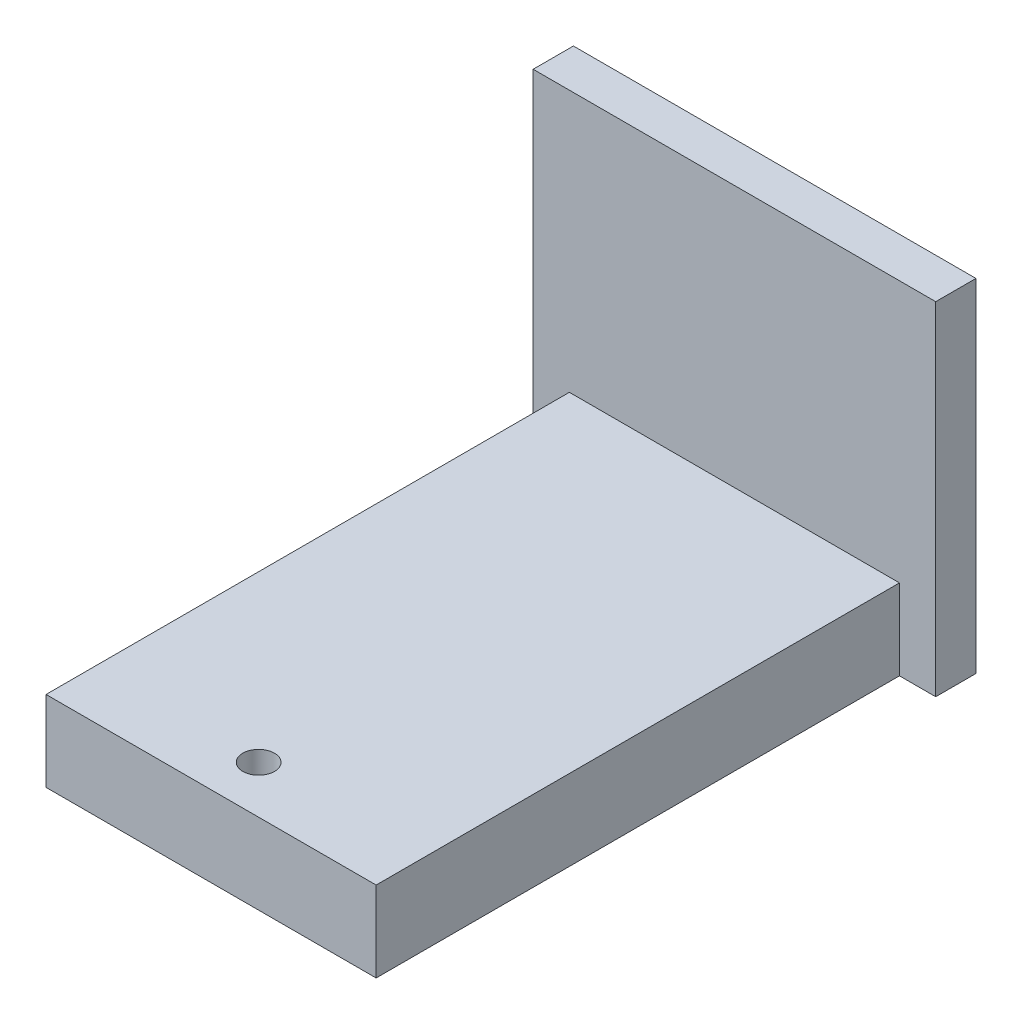
from build123d import *

# Parameters (mm, degrees)
SKETCH1_W           = 25.4
SKETCH1_H           = 25.4
BOSS_EXTRUDE1_DEPTH = 2.54
BOSS_EXTRUDE3_DEPTH = 2.54
SKETCH6_W           = 25.4
SKETCH6_H           = 3.81
CUT_EXTRUDE1_DEPTH  = 51.545361805
SKETCH7_R           = 1
CUT_EXTRUDE2_DEPTH  = 49.742196298


with BuildPart() as part:
    # Sketch1 → Boss-Extrude1 (new body)
    with BuildSketch(Plane.XY):
        with Locations((12.7, -12.7)):
            Rectangle(SKETCH1_W, SKETCH1_H)
    extrude(amount=BOSS_EXTRUDE1_DEPTH)

    # Sketch2 → Boss-Extrude3 (add, symmetric)
    with BuildSketch(Plane(origin=(0, -19.05, 0), x_dir=(1, 0, 0), z_dir=(0, 1, 0))):
        Polygon((2.286, -35.56), (2.286, -2.54), (12.7, -2.54), (23.114, -2.54), (23.114, -35.56), align=None)
    extrude(amount=BOSS_EXTRUDE3_DEPTH, both=True)

    # Sketch6 → Cut-Extrude1 (cut, through all)
    with BuildSketch(Plane.XY.offset(35.56)):
        with Locations((12.7, -23.495)):
            Rectangle(SKETCH6_W, SKETCH6_H)
    extrude(amount=-CUT_EXTRUDE1_DEPTH, mode=Mode.SUBTRACT)

    # Sketch7 → Cut-Extrude2 (cut, through all)
    with BuildSketch(Plane(origin=(0, -21.59, 0), x_dir=(-1, 0, 0), z_dir=(0, -1, 0))):
        with Locations(Location((-12.7, -32.56, 0), (0, 0, 90))):
            Circle(SKETCH7_R)
    extrude(amount=-CUT_EXTRUDE2_DEPTH, mode=Mode.SUBTRACT)


solid = part.part
